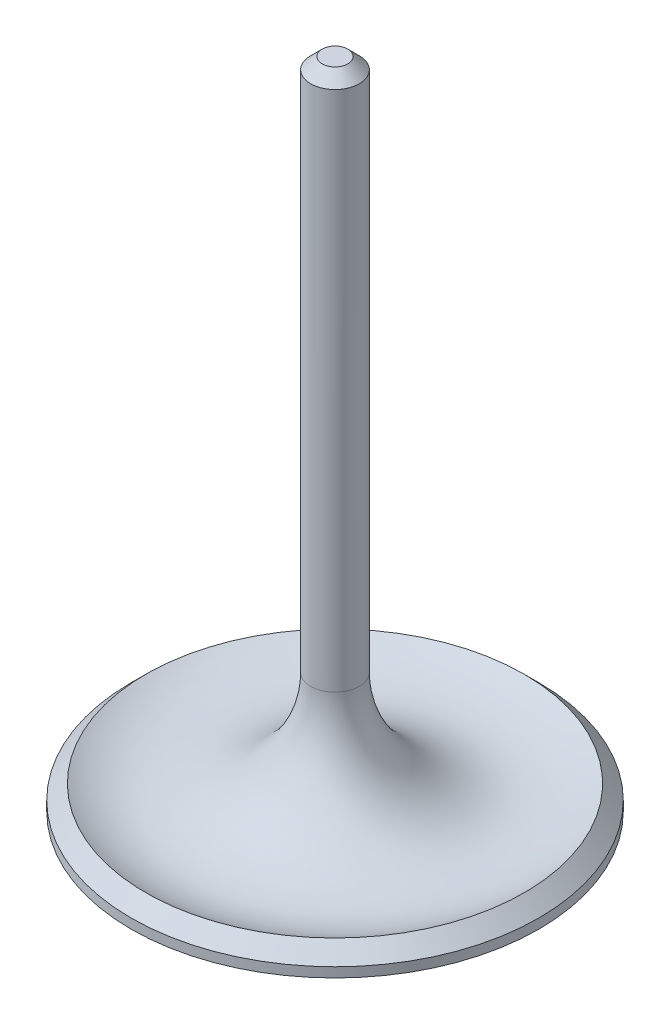
from build123d import *

# Parameters (mm, degrees)
CHAMFER1_SIZE = 1.5


with BuildPart() as part:
    # Sketch1 → Revolve1 (revolve)
    with BuildSketch(Plane.XY, mode=Mode.PRIVATE) as revolve1_sk:
        with BuildLine():
            Line((0, 0), (0, 85.55))
            Line((0, 85.55), (3.18, 85.55))
            Line((3.18, 85.55), (3.18, 15.766075305))
            ThreePointArc((3.18, 15.766075305), (10.355139161, 3.27502159), (24.76, 3.18))
            Line((24.76, 3.18), (26.67, 1.27))
            Line((26.67, 1.27), (26.67, 0))
            Line((26.67, 0), (0, 0))
        make_face()
    revolve(revolve1_sk.sketch.rotate(Axis((0, 0, 0), (0, 1, 0)), 90), axis=Axis((0, 0, 0), (0, 1, 0)))

    # Chamfer1
    chamfer1_edges = [part.edges().sort_by_distance(p)[0] for p in [
        (0, 85.55, 3.18),
    ]]
    chamfer(chamfer1_edges, length=CHAMFER1_SIZE)


solid = part.part
